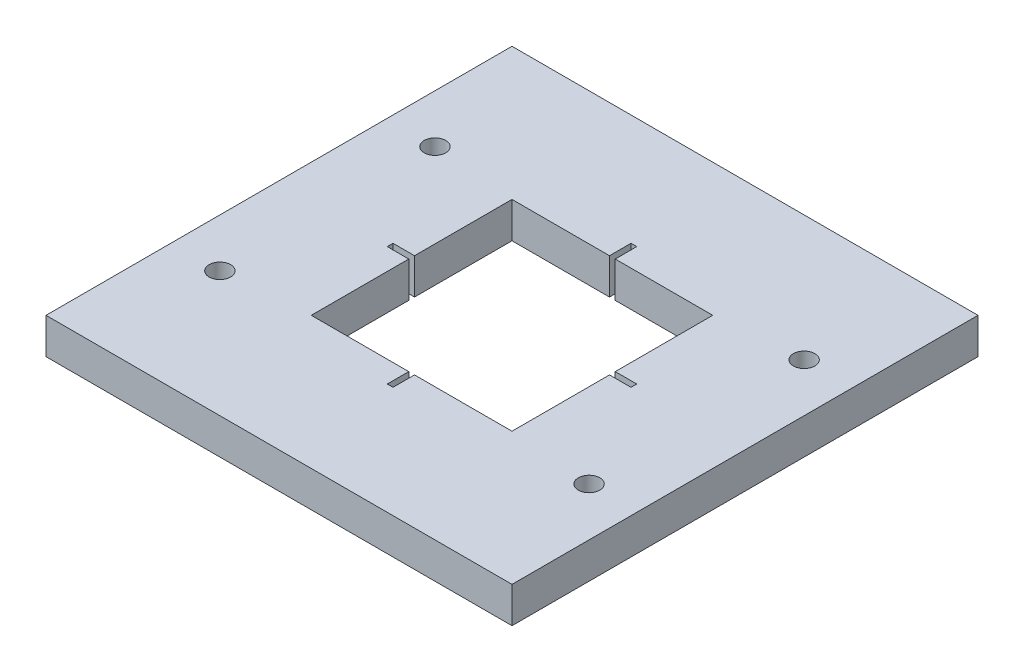
from build123d import *

# Parameters (mm, degrees)
CROQUIS1_W              = 55
CROQUIS1_H              = 55
CROQUIS1_R              = 1.5
SALIENTE_EXTRUIR1_DEPTH = 5
CROQUIS2_W              = 65
CROQUIS2_H              = 65
CROQUIS2_W_2            = 55
CROQUIS2_H_2            = 55
SALIENTE_EXTRUIR2_DEPTH = 5


with BuildPart() as part:
    # Croquis1 → Saliente-Extruir1 (new body)
    with BuildSketch(Plane(origin=(0, 0, 0), x_dir=(1, 0, 0), z_dir=(0, 1, 0))):
        with Locations((27.5, 27.5)):
            Rectangle(CROQUIS1_W, CROQUIS1_H)
        with Locations(Location((1.75, 42.5, 0), (0, 0, 270))):
            Circle(CROQUIS1_R, mode=Mode.SUBTRACT)
        with Locations(Location((1.75, 12.5, 0), (0, 0, 270))):
            Circle(CROQUIS1_R, mode=Mode.SUBTRACT)
        with Locations(Location((53.25, 42.5, 0), (0, 0, 90))):
            Circle(CROQUIS1_R, mode=Mode.SUBTRACT)
        with Locations(Location((53.25, 12.5, 0), (0, 0, 90))):
            Circle(CROQUIS1_R, mode=Mode.SUBTRACT)
        Polygon((13.5, 13.5), (27.1, 13.5), (27.1, 10.5), (27.9, 10.5), (27.9, 13.5), (41.5, 13.5), (41.5, 27.1), (44.5, 27.1), (44.5, 27.9), (41.5, 27.9), (41.5, 41.5), (27.9, 41.5), (27.9, 44.5), (27.1, 44.5), (27.1, 41.5), (13.5, 41.5), (13.5, 27.9), (10.5, 27.9), (10.5, 27.1), (13.5, 27.1), align=None, mode=Mode.SUBTRACT)
    extrude(amount=SALIENTE_EXTRUIR1_DEPTH)

    # Croquis2 → Saliente-Extruir2 (add)
    with BuildSketch(Plane(origin=(0, 5, 0), x_dir=(1, 0, 0), z_dir=(0, 1, 0))):
        with Locations((27.5, 27.5)):
            Rectangle(CROQUIS2_W, CROQUIS2_H)
        with Locations((27.5, 27.5)):
            Rectangle(CROQUIS2_W_2, CROQUIS2_H_2, mode=Mode.SUBTRACT)
    extrude(amount=-SALIENTE_EXTRUIR2_DEPTH)


solid = part.part
